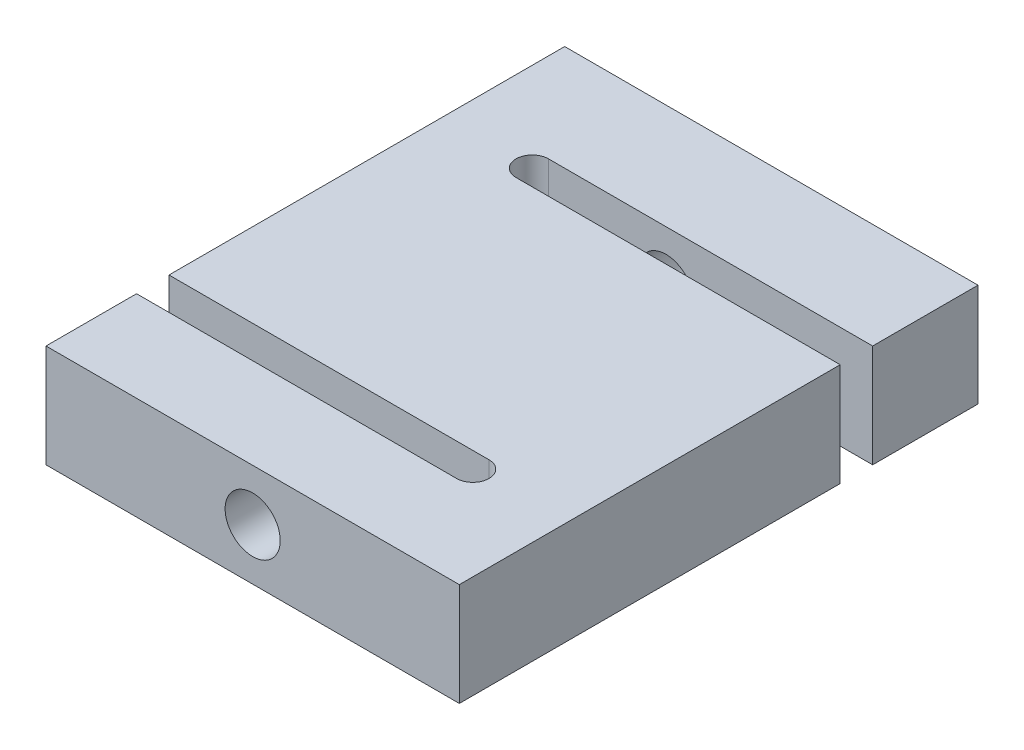
from build123d import *

# Parameters (mm, degrees)
SKETCH_1_W               = 51
SKETCH_1_H               = 64
EXTRUDE_1_DEPTH          = 6.35
CUT_EXTRUDE_1_DEPTH      = 43.843202495
PATTERN_CIRCULAR_1_COUNT = 2
HOLE_WIZARD_M8_1_D       = 6.8
HOLE_WIZARD_M8_1_DEPTH   = 13


with BuildPart() as part:
    # 草图1 → 凸台-拉伸1 (new, symmetric)
    with BuildSketch(Plane(origin=(0, 0, 0), x_dir=(1, 0, 0), z_dir=(0, 1, 0))):
        Rectangle(SKETCH_1_W, SKETCH_1_H)
    extrude(amount=EXTRUDE_1_DEPTH, both=True)

    # 草图2 → 切除-拉伸1 (cut, through all)
    with BuildSketch(Plane(origin=(0, 6.35, 0), x_dir=(1, 0, 0), z_dir=(0, 1, 0))):
        with BuildLine():
            Line((25.5, 15), (-14.5, 15))
            ThreePointArc((-14.5, 15), (-16.5, 17), (-14.5, 19))
            Line((-14.5, 19), (25.5, 19))
            ThreePointArc((25.5, 19), (27.5, 17), (25.5, 15))
        make_face()
    cut_extrude_1 = extrude(amount=-CUT_EXTRUDE_1_DEPTH, mode=Mode.SUBTRACT)

    # 阵列(圆周)1: 切除-拉伸1 ×2 about axis
    pattern_circular_1_axis = Axis((-0.252947744, 0, 0.912547634), (0, 1, 0))
    for i in range(1, PATTERN_CIRCULAR_1_COUNT):
        add(cut_extrude_1.rotate(pattern_circular_1_axis, i * 360 / PATTERN_CIRCULAR_1_COUNT), mode=Mode.SUBTRACT)

    # M8 螺纹孔1
    with Locations(Plane(origin=(0, 0, -32), x_dir=(-1, 0, 0), z_dir=(0, 0, -1))):
        with Locations((0, 0)):
            hole_wizard_m8_1 = Hole(HOLE_WIZARD_M8_1_D / 2, depth=HOLE_WIZARD_M8_1_DEPTH)

    # 镜向1: M8 螺纹孔1 across plane
    add(hole_wizard_m8_1.mirror(Plane.XY), mode=Mode.SUBTRACT)


solid = part.part
